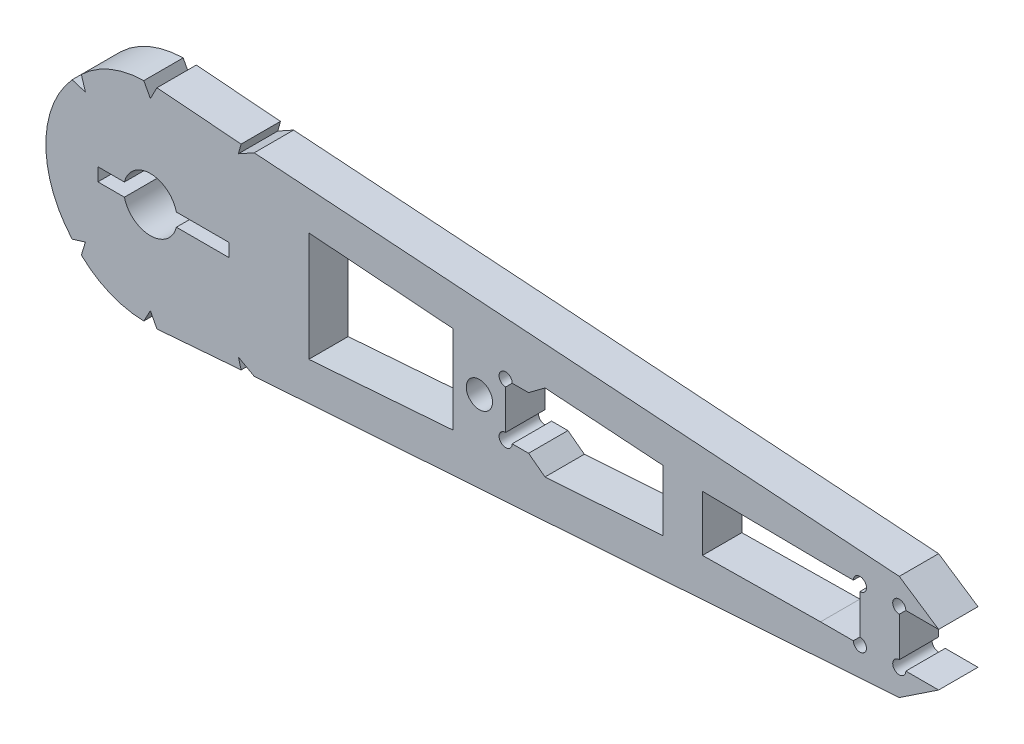
from build123d import *

# Parameters (mm, degrees)
SKETCH_1_R      = 1.000000438
EXTRUDE_1_DEPTH = 3


with BuildPart() as part:
    # 草图1 → 凸台-拉伸1 (new body)
    with BuildSketch(Plane.XY):
        with BuildLine():
            Line((60.073949397, -2.000000095), (57.073947042, -4.00000019))
            Line((57.073947042, -4.00000019), (7.913790643, -7.376036607))
            Line((7.913790643, -7.376036607), (6.708230358, -6.708230358))
            Line((6.708230358, -6.708230358), (6.916883867, -7.454637904))
            Line((6.916883867, -7.454637904), (0.500000024, -7.960577495))
            Line((0.500000024, -7.960577495), (0, -7.000000216))
            Line((0, -7.000000216), (-0.500000024, -7.934173569))
            ThreePointArc((-0.500000024, -7.934173569), (-3.067102082, -7.398918018), (-5.260177422, -5.961235147))
            Line((-5.260177422, -5.961235147), (-4.949747585, -4.949747585))
            Line((-4.949747585, -4.949747585), (-5.961235147, -5.260177422))
            ThreePointArc((-5.961235147, -5.260177422), (-7.966566676, 0), (-5.961235147, 5.260177422))
            Line((-5.961235147, 5.260177422), (-4.949747585, 4.949747585))
            Line((-4.949747585, 4.949747585), (-5.260177422, 5.961235147))
            ThreePointArc((-5.260177422, 5.961235147), (-3.067102082, 7.398918018), (-0.500000024, 7.934173569))
            Line((-0.500000024, 7.934173569), (0, 7.000000216))
            Line((0, 7.000000216), (0.500000024, 7.960577495))
            Line((0.500000024, 7.960577495), (6.916883867, 7.454637904))
            Line((6.916883867, 7.454637904), (6.708230358, 6.708230358))
            Line((6.708230358, 6.708230358), (7.913790643, 7.376036607))
            Line((7.913790643, 7.376036607), (57.073947042, 4.00000019))
            Line((57.073947042, 4.00000019), (60.073949397, 2.000000095))
            Line((60.073949397, 2.000000095), (57.573948056, 2.000000095))
            ThreePointArc((57.573948056, 2.000000095), (56.720394687, 2.35355404), (57.073947042, 1.500000013))
            Line((57.073947042, 1.500000013), (57.073947042, -1.500000013))
            ThreePointArc((57.073947042, -1.500000013), (56.720394687, -2.35355404), (57.573948055, -2.000000095))
            Line((57.573948055, -2.000000095), (60.073949397, -2.000000095))
        make_face()
        with Locations((25.073947659, -3.992e-06)):
            Circle(SKETCH_1_R, mode=Mode.SUBTRACT)
        with BuildLine():
            Line((42.073946446, 2.116752788), (51.073949784, 2.000000095))
            Line((51.073949784, 2.000000095), (53.5739474, 2.000000095))
            ThreePointArc((53.5739474, 2.000000095), (54.427500768, 2.35355404), (54.073948413, 1.500000013))
            Line((54.073948413, 1.500000013), (54.073948413, -1.500000013))
            ThreePointArc((54.073948413, -1.500000013), (54.427500768, -2.35355404), (53.5739474, -2.000000095))
            Line((53.5739474, -2.000000095), (51.073949784, -2.000000095))
            Line((51.073949784, -2.000000095), (42.073946446, -2.116752788))
            Line((42.073946446, -2.116752788), (42.073946446, 2.116752788))
        make_face(mode=Mode.SUBTRACT)
        with BuildLine():
            Line((27.573948726, 2.000000095), (28.823947534, 2.000000095))
            Line((28.823947534, 2.000000095), (30.073948204, 2.9390899))
            Line((30.073948204, 2.9390899), (39.073947817, 2.322337125))
            Line((39.073947817, 2.322337125), (39.073947817, -2.322337125))
            Line((39.073947817, -2.322337125), (30.073948204, -2.9390899))
            Line((30.073948204, -2.9390899), (28.823947534, -2.000000095))
            Line((28.823947534, -2.000000095), (27.573948726, -2.000000095))
            ThreePointArc((27.573948726, -2.000000095), (26.720395358, -2.35355404), (27.073947713, -1.500000013))
            Line((27.073947713, -1.500000013), (27.073947713, 1.500000013))
            ThreePointArc((27.073947713, 1.500000013), (26.720395358, 2.35355404), (27.573948726, 2.000000095))
        make_face(mode=Mode.SUBTRACT)
        with BuildLine():
            Line((-4.00000019, 0.500000024), (-1.980265602, 0.500000024))
            ThreePointArc((-1.980265602, 0.500000024), (0, 2.052275233), (1.980265603, 0.500000024))
            Line((1.980265603, 0.500000024), (6.000000052, 0.500000024))
            Line((6.000000052, 0.500000024), (6.000000052, -0.500000024))
            Line((6.000000052, -0.500000024), (1.980265602, -0.500000024))
            ThreePointArc((1.980265602, -0.500000024), (0, -2.052275233), (-1.980265603, -0.500000024))
            Line((-1.980265603, -0.500000024), (-4.00000019, -0.500000024))
            Line((-4.00000019, -0.500000024), (-4.00000019, 0.500000024))
        make_face(mode=Mode.SUBTRACT)
        Polygon((12.073948048, -4.172595218), (23.07394892, -3.350258339), (23.07394892, 3.350258339), (12.073948048, 4.172595218), align=None, mode=Mode.SUBTRACT)
    extrude(amount=EXTRUDE_1_DEPTH)


solid = part.part
